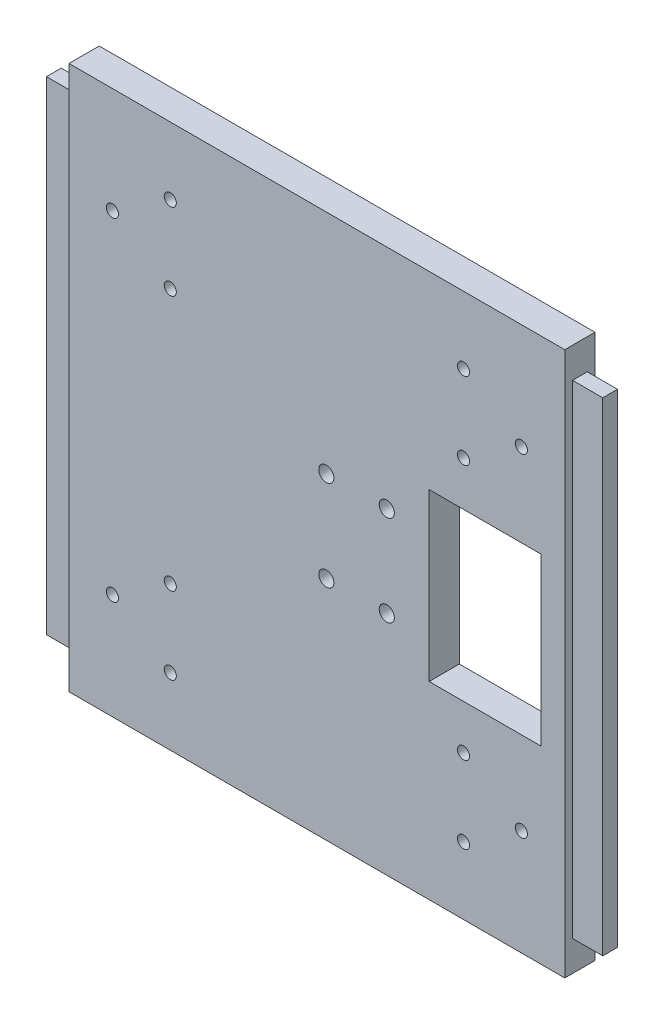
from build123d import *

# Parameters (mm, degrees)
SKETCH_1_W          = 164
SKETCH_1_H          = 180
EXTRUDE_1_DEPTH     = 10
SKETCH_2_W          = 4.88
SKETCH_2_H          = 159.88
EXTRUDE_2_DEPTH     = 10
SKETCH_3_R          = 2
CUT_EXTRUDE_1_DEPTH = 10
SKETCH_5_R          = 2.5
SKETCH_5_W          = 37
SKETCH_5_H          = 55
CUT_EXTRUDE_3_DEPTH = 8
SKETCH_6_W          = 37
SKETCH_6_H          = 55
CUT_EXTRUDE_4_DEPTH = 8


with BuildPart() as part:
    # 草图1 → 凸台-拉伸1 (new body)
    with BuildSketch(Plane.XY):
        with Locations((82, 90)):
            Rectangle(SKETCH_1_W, SKETCH_1_H)
    extrude(amount=EXTRUDE_1_DEPTH)

    # 草图2 → 凸台-拉伸2 (add)
    with BuildSketch(Plane.ZY):
        with Locations((5, 90)):
            Rectangle(SKETCH_2_W, SKETCH_2_H)
    extrude_2 = extrude(amount=EXTRUDE_2_DEPTH)

    # 镜向1: 凸台-拉伸2 across plane
    add(extrude_2.mirror(Plane(origin=(82, 0, 0), x_dir=(0, 0, 1), z_dir=(1, 0, 0))))

    # 草图3 → 切除-拉伸1 (cut)
    with BuildSketch(Plane(origin=(0, 0, 0), x_dir=(-1, 0, 0), z_dir=(0, 0, -1))):
        with Locations((-149.6425573, 145)):
            Circle(SKETCH_3_R)
        with Locations((-130.5, 157.75)):
            Circle(SKETCH_3_R)
        with Locations((-130.5, 132.25)):
            Circle(SKETCH_3_R)
        with Locations((-14.3574427, 145)):
            Circle(SKETCH_3_R)
        with Locations((-33.5, 157.75)):
            Circle(SKETCH_3_R)
        with Locations((-33.5, 132.25)):
            Circle(SKETCH_3_R)
        with Locations(Location((-130.5, 47.75, 0), (0, 0, 180))):
            Circle(SKETCH_3_R)
        with Locations(Location((-130.5, 22.25, 0), (0, 0, 180))):
            Circle(SKETCH_3_R)
        with Locations(Location((-149.6425573, 35, 0), (0, 0, 180))):
            Circle(SKETCH_3_R)
        with Locations(Location((-33.5, 47.75, 0), (0, 0, 180))):
            Circle(SKETCH_3_R)
        with Locations(Location((-33.5, 22.25, 0), (0, 0, 180))):
            Circle(SKETCH_3_R)
        with Locations(Location((-14.3574427, 35, 0), (0, 0, 180))):
            Circle(SKETCH_3_R)
    extrude(amount=-CUT_EXTRUDE_1_DEPTH, mode=Mode.SUBTRACT)

    # 草图5 → 切除-拉伸3 (cut)
    with BuildSketch(Plane.XY.offset(10)):
        with Locations((85.117863175, 105)):
            Circle(SKETCH_5_R)
        with Locations((85.117863175, 75)):
            Circle(SKETCH_5_R)
        with Locations((105.117863175, 105)):
            Circle(SKETCH_5_R)
        with Locations((105.117863175, 75)):
            Circle(SKETCH_5_R)
        with Locations((137.617863175, 90)):
            Rectangle(SKETCH_5_W, SKETCH_5_H)
    extrude(amount=-CUT_EXTRUDE_3_DEPTH, mode=Mode.SUBTRACT)

    # 草图6 → 切除-拉伸4 (cut)
    with BuildSketch(Plane.XY.offset(2)):
        with Locations((137.617863175, 90)):
            Rectangle(SKETCH_6_W, SKETCH_6_H)
    extrude(amount=-CUT_EXTRUDE_4_DEPTH, mode=Mode.SUBTRACT)


solid = part.part
